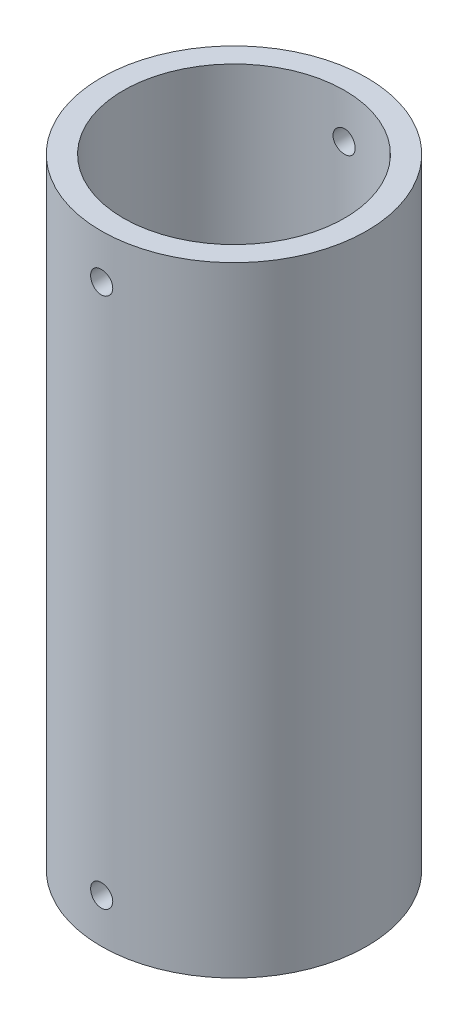
from build123d import *

# Parameters (mm, degrees)
SKETCH1_R               = 38.1
SKETCH1_R_2             = 31.75
BOSS_EXTRUDE1_DEPTH     = 177.8
CUT_EXTRUDE1_DEPTH      = 186.784983247
CUT_EXTRUDE1_DEPTH_BACK = 186.784983247
SKETCH2_R               = 3.175


with BuildPart() as part:
    # Sketch1 → Boss-Extrude1 (new body)
    with BuildSketch(Plane(origin=(0, 0, 0), x_dir=(1, 0, 0), z_dir=(0, 1, 0))):
        with Locations(Location((0, 0, 0), (0, 0, 270))):
            Circle(SKETCH1_R)
        with Locations(Location((0, 0, 0), (0, 0, 270))):
            Circle(SKETCH1_R_2, mode=Mode.SUBTRACT)
    extrude(amount=BOSS_EXTRUDE1_DEPTH)

    # Sketch2 → Cut-Extrude1 (cut, two sides: drawn at the far end of the back side and taken through both)
    with BuildSketch(Plane.XY.offset(-CUT_EXTRUDE1_DEPTH_BACK)):
        with Locations((0, 165.1)):
            Circle(SKETCH2_R)
        with Locations((0, 12.7)):
            Circle(SKETCH2_R)
    extrude(amount=CUT_EXTRUDE1_DEPTH + CUT_EXTRUDE1_DEPTH_BACK, mode=Mode.SUBTRACT)


solid = part.part
